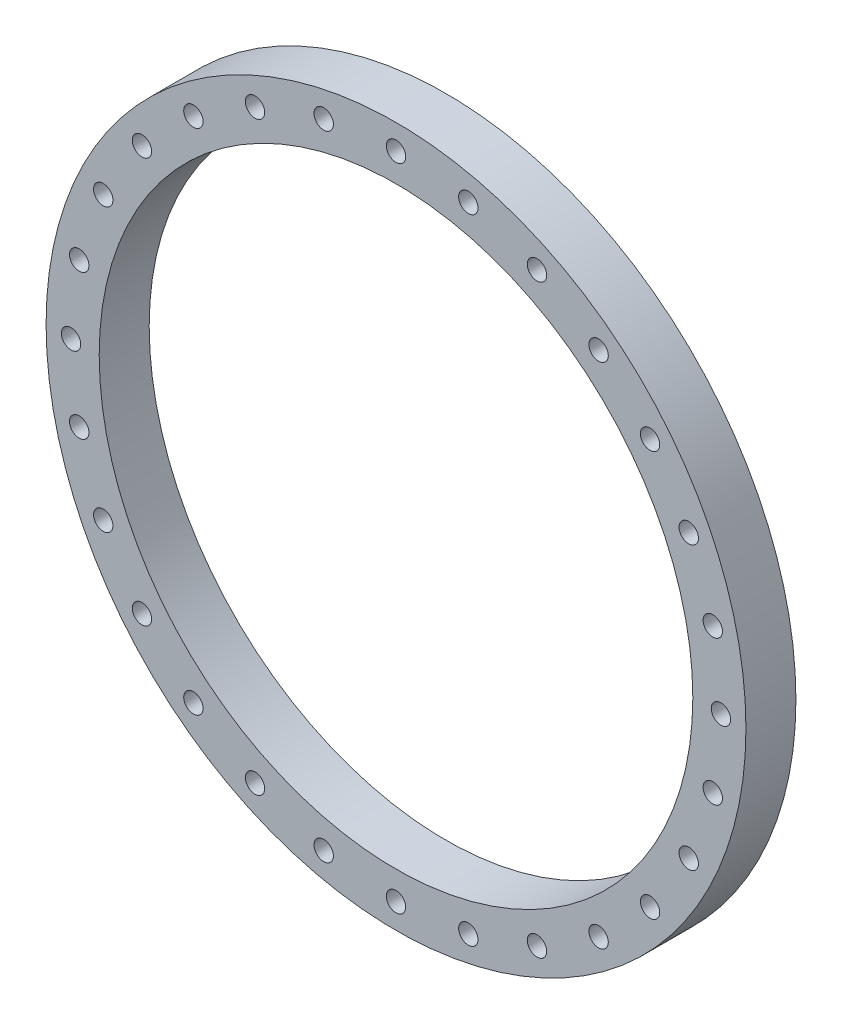
from build123d import *

# Parameters (mm, degrees)
SKETCH_1_R      = 56
SKETCH_1_R_2    = 47.5
SKETCH_1_R_3    = 1.55
EXTRUDE_1_DEPTH = 8


with BuildPart() as part:
    # 草图1 → 凸台-拉伸1 (new body)
    with BuildSketch(Plane.XY):
        Circle(SKETCH_1_R)
        Circle(SKETCH_1_R_2, mode=Mode.SUBTRACT)
        with Locations((0, 52)):
            Circle(SKETCH_1_R_3, mode=Mode.SUBTRACT)
        with Locations((11.571088566, 50.696251433)):
            Circle(SKETCH_1_R_3, mode=Mode.SUBTRACT)
        with Locations((22.561954434, 46.850381131)):
            Circle(SKETCH_1_R_3, mode=Mode.SUBTRACT)
        with Locations((32.421469697, 40.655237088)):
            Circle(SKETCH_1_R_3, mode=Mode.SUBTRACT)
        with Locations((40.655237088, 32.421469697)):
            Circle(SKETCH_1_R_3, mode=Mode.SUBTRACT)
        with Locations((46.850381131, 22.561954434)):
            Circle(SKETCH_1_R_3, mode=Mode.SUBTRACT)
        with Locations((50.696251433, 11.571088566)):
            Circle(SKETCH_1_R_3, mode=Mode.SUBTRACT)
        with Locations((52, 0)):
            Circle(SKETCH_1_R_3, mode=Mode.SUBTRACT)
        with Locations((50.696251433, -11.571088566)):
            Circle(SKETCH_1_R_3, mode=Mode.SUBTRACT)
        with Locations((46.850381131, -22.561954434)):
            Circle(SKETCH_1_R_3, mode=Mode.SUBTRACT)
        with Locations((40.655237088, -32.421469697)):
            Circle(SKETCH_1_R_3, mode=Mode.SUBTRACT)
        with Locations((32.421469697, -40.655237088)):
            Circle(SKETCH_1_R_3, mode=Mode.SUBTRACT)
        with Locations((22.561954434, -46.850381131)):
            Circle(SKETCH_1_R_3, mode=Mode.SUBTRACT)
        with Locations((11.571088566, -50.696251433)):
            Circle(SKETCH_1_R_3, mode=Mode.SUBTRACT)
        with Locations((0, -52)):
            Circle(SKETCH_1_R_3, mode=Mode.SUBTRACT)
        with Locations((-11.571088566, -50.696251433)):
            Circle(SKETCH_1_R_3, mode=Mode.SUBTRACT)
        with Locations((-22.561954434, -46.850381131)):
            Circle(SKETCH_1_R_3, mode=Mode.SUBTRACT)
        with Locations((-32.421469697, -40.655237088)):
            Circle(SKETCH_1_R_3, mode=Mode.SUBTRACT)
        with Locations((-40.655237088, -32.421469697)):
            Circle(SKETCH_1_R_3, mode=Mode.SUBTRACT)
        with Locations((-46.850381131, -22.561954434)):
            Circle(SKETCH_1_R_3, mode=Mode.SUBTRACT)
        with Locations((-50.696251433, -11.571088566)):
            Circle(SKETCH_1_R_3, mode=Mode.SUBTRACT)
        with Locations((-52, 0)):
            Circle(SKETCH_1_R_3, mode=Mode.SUBTRACT)
        with Locations((-50.696251433, 11.571088566)):
            Circle(SKETCH_1_R_3, mode=Mode.SUBTRACT)
        with Locations((-46.850381131, 22.561954434)):
            Circle(SKETCH_1_R_3, mode=Mode.SUBTRACT)
        with Locations((-40.655237088, 32.421469697)):
            Circle(SKETCH_1_R_3, mode=Mode.SUBTRACT)
        with Locations((-32.421469697, 40.655237088)):
            Circle(SKETCH_1_R_3, mode=Mode.SUBTRACT)
        with Locations((-22.561954434, 46.850381131)):
            Circle(SKETCH_1_R_3, mode=Mode.SUBTRACT)
        with Locations((-11.571088566, 50.696251433)):
            Circle(SKETCH_1_R_3, mode=Mode.SUBTRACT)
    extrude(amount=EXTRUDE_1_DEPTH)


solid = part.part
